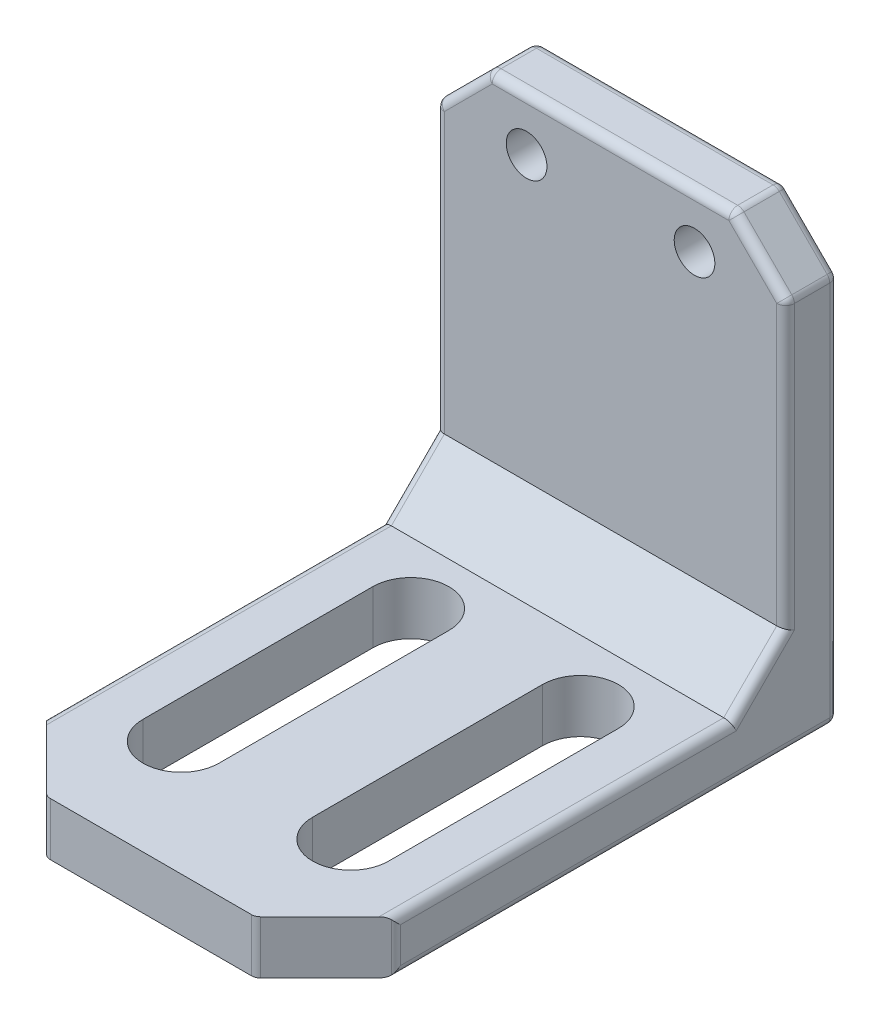
from build123d import *

# Parameters (mm, degrees)
SKETCH1_W           = 19.8
SKETCH1_H           = 25
SKETCH1_R           = 1.15
BOSS_EXTRUDE1_DEPTH = 3
SKETCH2_W           = 19.8
SKETCH2_H           = 3
BOSS_EXTRUDE2_DEPTH = 26
CHAMFER1_SIZE       = 3
CUT_EXTRUDE1_DEPTH  = 15
CHAMFER2_SIZE       = 4
FILLET2_R           = 0.5


with BuildPart() as part:
    # Sketch1 → Boss-Extrude1 (new body)
    with BuildSketch(Plane.XY):
        with Locations((0, 1.287671233)):
            Rectangle(SKETCH1_W, SKETCH1_H)
        with Locations((-4.75, 10.787671233)):
            Circle(SKETCH1_R, mode=Mode.SUBTRACT)
        with Locations(Location((4.75, 10.787671233, 0), (0, 0, 180))):
            Circle(SKETCH1_R, mode=Mode.SUBTRACT)
    extrude(amount=BOSS_EXTRUDE1_DEPTH)

    # Sketch2 → Boss-Extrude2 (add)
    with BuildSketch(Plane.XY.offset(3)):
        with Locations((0, -9.712328767)):
            Rectangle(SKETCH2_W, SKETCH2_H)
    extrude(amount=BOSS_EXTRUDE2_DEPTH)

    # Chamfer1
    chamfer1_edges = [part.edges().sort_by_distance(p)[0] for p in [
        (0, -8.212328767, 3),
        (-9.9, 13.787671233, 1.5),
        (9.9, 13.787671233, 1.5),
    ]]
    chamfer(chamfer1_edges, length=CHAMFER1_SIZE)

    # Sketch4 → Cut-Extrude1 (cut)
    with BuildSketch(Plane(origin=(0, -8.212328767, 0), x_dir=(1, 0, 0), z_dir=(0, 1, 0))):
        with BuildLine():
            Line((2.647058824, -22.5), (2.647058824, -9.5))
            ThreePointArc((2.647058824, -9.5), (4.797058824, -7.35), (6.947058824, -9.5))
            Line((6.947058824, -9.5), (6.947058824, -22.5))
            ThreePointArc((6.947058824, -22.5), (4.797058824, -24.65), (2.647058824, -22.5))
        make_face()
        with BuildLine():
            Line((-2.647058824, -22.5), (-2.647058824, -9.5))
            ThreePointArc((-2.647058824, -9.5), (-4.797058824, -7.35), (-6.947058824, -9.5))
            Line((-6.947058824, -9.5), (-6.947058824, -22.5))
            ThreePointArc((-6.947058824, -22.5), (-4.797058824, -24.65), (-2.647058824, -22.5))
        make_face()
    extrude(amount=-CUT_EXTRUDE1_DEPTH, mode=Mode.SUBTRACT)

    # Chamfer2
    chamfer2_edges = [part.edges().sort_by_distance(p)[0] for p in [
        (-9.9, -9.712328767, 29),
        (9.9, -9.712328767, 29),
    ]]
    chamfer(chamfer2_edges, length=CHAMFER2_SIZE)

    # Fillet2
    fillet2_edges = [part.edges().sort_by_distance(p)[0] for p in [
        (-5.9, 10.787671233, 0),
        (5.9, 10.787671233, 0),
        (0, 13.787671233, 0),
        (0, 13.787671233, 3),
        (-6.9, 13.787671233, 1.5),
        (6.9, 13.787671233, 1.5),
        (-9.9, -0.212328767, 0),
        (-8.4, 12.287671233, 0),
        (8.4, 12.287671233, 0),
        (9.9, 2.787671233, 3),
        (9.9, 10.787671233, 1.5),
        (-9.9, 2.787671233, 3),
        (-8.4, 12.287671233, 3),
        (8.4, 12.287671233, 3),
        (-9.9, 10.787671233, 1.5),
        (-9.9, -6.712328767, 4.5),
        (9.9, -6.712328767, 4.5),
        (0, -11.212328767, 0),
        (9.9, -0.212328767, 0),
        (-5.9, -9.712328767, 29),
        (5.9, -9.712328767, 29),
        (9.9, -8.212328767, 15.5),
        (-9.9, -8.212328767, 15.5),
        (9.9, -11.212328767, 12.5),
        (9.9, -9.712328767, 25),
        (-9.9, -11.212328767, 12.5),
        (-9.9, -9.712328767, 25),
    ]]
    fillet(fillet2_edges, radius=FILLET2_R)


solid = part.part
